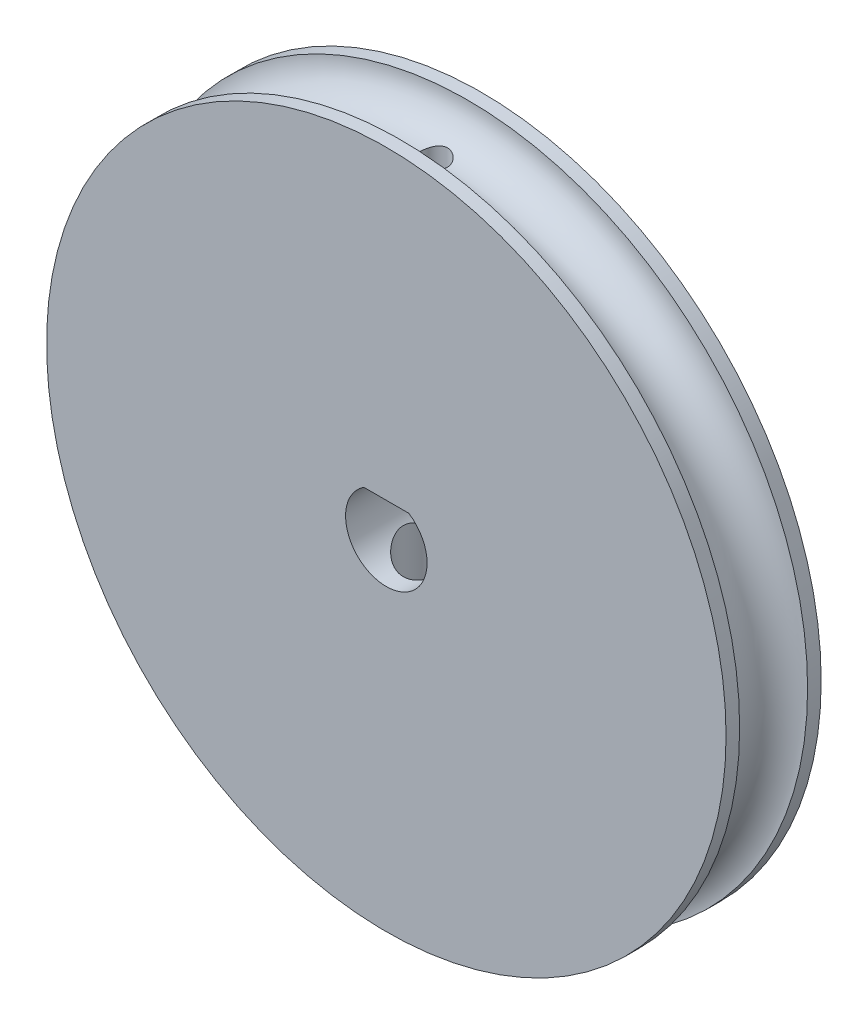
from build123d import *

# Parameters (mm, degrees)
CUT_EXTRUDE1_DEPTH      = 37.041642582
CUT_EXTRUDE2_DEPTH      = 37.041642582
CUT_EXTRUDE2_DEPTH_BACK = 37.041642582
SKETCH4_R               = 1
SKETCH6_R               = 2.25
CUT_EXTRUDE3_DEPTH      = 37.04164274


with BuildPart() as part:
    # Sketch2 → Revolve1 (revolve)
    with BuildSketch(Plane(origin=(0, 0, 0), x_dir=(1, 0, 0), z_dir=(0, 1, 0))):
        with BuildLine():
            Line((25, 6), (25, 7))
            Line((25, 7), (0, 7))
            Line((0, 7), (0, 0))
            Line((0, 0), (25, 0))
            Line((25, 0), (25, 1))
            ThreePointArc((25, 1), (22.5, 3.5), (25, 6))
        make_face()
    revolve(axis=Axis((0, 0, 0), (0, 0, -1)))

    # Sketch3 → Cut-Extrude1 (cut, through all)
    with BuildSketch(Plane.XY):
        with BuildLine():
            Line((-1.658312395, 2.5), (1.658312395, 2.5))
            ThreePointArc((1.658312395, 2.5), (0, -3), (-1.658312395, 2.5))
        make_face()
    extrude(amount=-CUT_EXTRUDE1_DEPTH, mode=Mode.SUBTRACT)

    # Sketch4 → Cut-Extrude2 (cut, two sides: drawn at the far end of the back side and taken through both)
    with BuildSketch(Plane(origin=(0, 0, 0), x_dir=(1, 0, 0), z_dir=(0, 1, 0)).offset(-CUT_EXTRUDE2_DEPTH_BACK)):
        with Locations(Location((0, 3.5, 0), (0, 0, 270))):
            Circle(SKETCH4_R)
    extrude(amount=CUT_EXTRUDE2_DEPTH + CUT_EXTRUDE2_DEPTH_BACK, mode=Mode.SUBTRACT)

    # Sketch6 → Cut-Extrude3 (cut, through all)
    with BuildSketch(Plane(origin=(0, 0, 0), x_dir=(1, 0, 0), z_dir=(0, 1, 0))):
        with Locations(Location((0, 3.5, 0), (0, 0, 270))):
            Circle(SKETCH6_R)
    extrude(amount=-CUT_EXTRUDE3_DEPTH, mode=Mode.SUBTRACT)


solid = part.part
